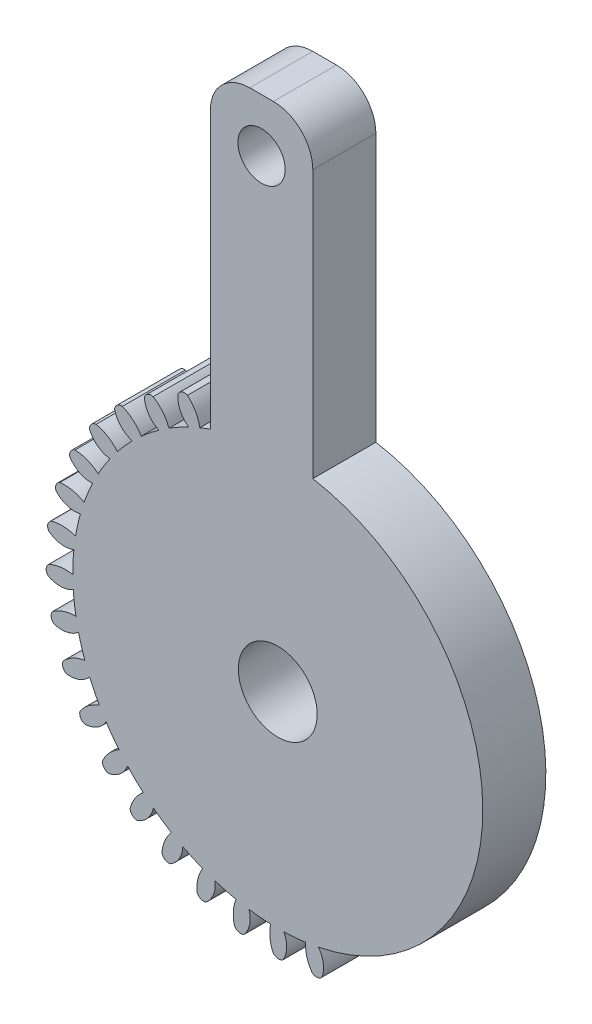
from build123d import *

# Parameters (mm, degrees)
SKETCH1_R           = 13
BOSS_EXTRUDE1_DEPTH = 4
BOSS_EXTRUDE2_DEPTH = 4
CIRPATTERN1_COUNT   = 37
CUT_EXTRUDE1_START  = -6
CUT_EXTRUDE1_DEPTH  = 6
SKETCH5_W           = 6.5
SKETCH5_H           = 20
BOSS_EXTRUDE3_DEPTH = 4
FILLET1_R           = 2.5
SKETCH6_R           = 2.5
CUT_EXTRUDE2_DEPTH  = 36.685455193
SKETCH7_R           = 1.5
CUT_EXTRUDE3_DEPTH  = 36.685455193


with BuildPart() as part:
    # Sketch1 → Boss-Extrude1 (new body)
    with BuildSketch(Plane.XY):
        Circle(SKETCH1_R)
    extrude(amount=BOSS_EXTRUDE1_DEPTH)

    # Sketch2 → Boss-Extrude2 (add)
    with BuildSketch(Plane.XY.offset(4)):
        with BuildLine():
            Line((-1.442756516, 12.919692475), (-0.673396871, 12.982547387))
            ThreePointArc((-0.673396871, 12.982547387), (-0.676161598, 13.791154594), (-0.946073249, 14.553388784))
            ThreePointArc((-0.946073249, 14.553388784), (-1.263795502, 14.68499365), (-1.581517754, 14.553388784))
            ThreePointArc((-1.581517754, 14.553388784), (-1.735779337, 13.717545135), (-1.442756516, 12.919692475))
        make_face()
    boss_extrude2 = extrude(amount=-BOSS_EXTRUDE2_DEPTH)

    # CirPattern1: Boss-Extrude2 ×37 about axis
    cirpattern1_axis = Axis((-0.003550518, 0.04085181, 0), (0, 0, 1))
    for i in range(1, CIRPATTERN1_COUNT):
        add(boss_extrude2.rotate(cirpattern1_axis, i * 360 / CIRPATTERN1_COUNT))

    # Sketch3 → Cut-Extrude1 (cut)
    with BuildSketch(Plane.XY.offset(4).offset(CUT_EXTRUDE1_START)):
        with BuildLine():
            ThreePointArc((2.580226265, -12.741366976), (12.998773331, -0.178582984), (2.929279614, 12.665674911))
            ThreePointArc((2.929279614, 12.665674911), (2.706489738, 14.000196281), (3.492602617, 15.101381624))
            ThreePointArc((3.492602617, 15.101381624), (15.498537433, -0.212925866), (3.076423624, -15.191629856))
            ThreePointArc((3.076423624, -15.191629856), (3.335791003, -13.863732578), (2.580226265, -12.741366976))
        make_face()
    extrude(amount=CUT_EXTRUDE1_DEPTH, mode=Mode.SUBTRACT)

    # Sketch5 → Boss-Extrude3 (add)
    with BuildSketch(Plane.XY.offset(4)):
        with Locations((-1.029483868, 22.275423326)):
            Rectangle(SKETCH5_W, SKETCH5_H)
    extrude(amount=-BOSS_EXTRUDE3_DEPTH)

    # Fillet1
    fillet1_edges = [part.edges().sort_by_distance(p)[0] for p in [
        (2.220516132, 32.275423326, 2),
        (-4.279483868, 32.275423326, 2),
    ]]
    fillet(fillet1_edges, radius=FILLET1_R)

    # Sketch6 → Cut-Extrude2 (cut, through all)
    with BuildSketch(Plane.XY.offset(4)):
        Circle(SKETCH6_R)
    extrude(amount=-CUT_EXTRUDE2_DEPTH, mode=Mode.SUBTRACT)

    # Sketch7 → Cut-Extrude3 (cut, through all)
    with BuildSketch(Plane.XY.offset(4)):
        with Locations((-1.029483868, 28.906928641)):
            Circle(SKETCH7_R)
    extrude(amount=-CUT_EXTRUDE3_DEPTH, mode=Mode.SUBTRACT)


solid = part.part
